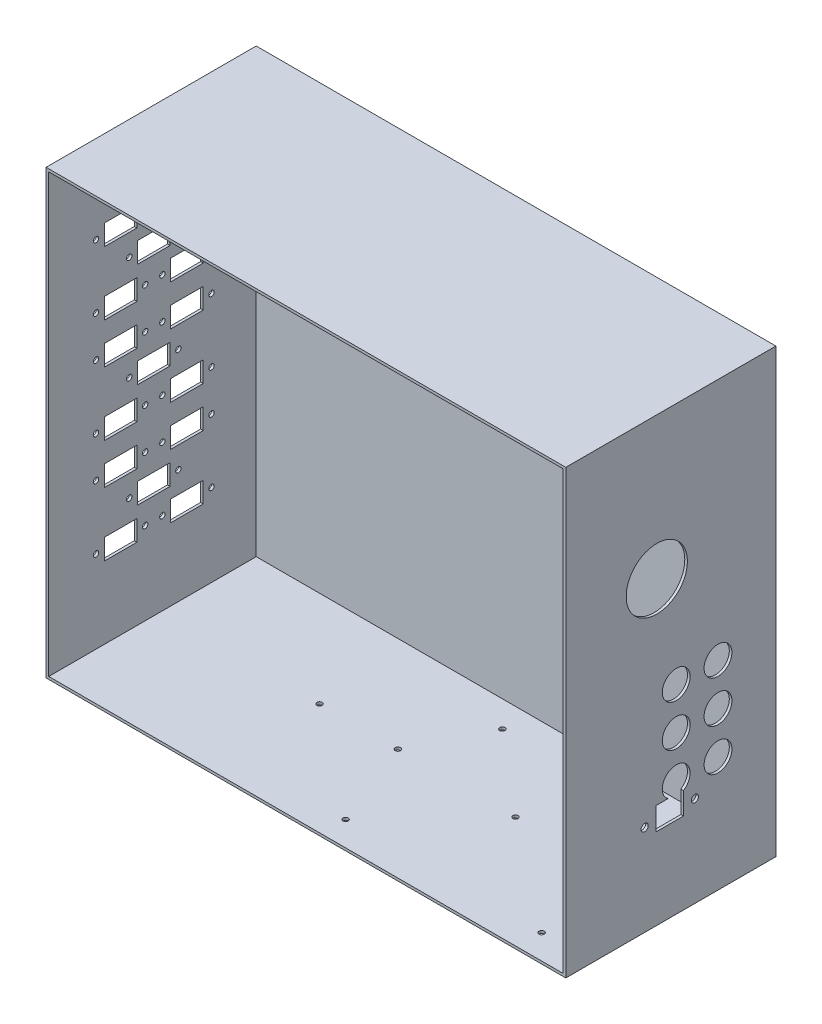
from build123d import *

# Parameters (mm, degrees)
SKETCH2_W                        = 298.45
SKETCH2_H                        = 254
BOSS_EXTRUDE1_DEPTH              = 120.65
SHELL1_T                         = -1.5
PT_CONNECTOR_CUTOUTS_REACH       = 348.06
SKETCH3_R                        = 8
SKETCH4_R                        = 1.55
SKETCH4_W                        = 18.7
SKETCH4_H                        = 11.8
SOLENOID_CONNECTOR_CUTOUTS_DEPTH = 1.5
SKETCH5_R                        = 1.524
PCB_MOUNTING_HOLES_DEPTH         = 1.5
SKETCH6_R                        = 17.574098895
CUT_EXTRUDE2_DEPTH               = 1.5
SKETCH7_R                        = 10.735729294
SKETCH7_R_2                      = 9.212667567
SKETCH7_R_3                      = 5.203861924
SKETCH7_R_4                      = 2.440691802
CUT_EXTRUDE3_DEPTH               = 1.5
SKETCH8_R                        = 2.06375
SKETCH8_W                        = 15.748
SKETCH8_H                        = 13.081
CUT_EXTRUDE4_DEPTH               = 1.5


with BuildPart() as part:
    # Sketch2 → Boss-Extrude1 (new body)
    with BuildSketch(Plane.XY):
        Rectangle(SKETCH2_W, SKETCH2_H)
    extrude(amount=BOSS_EXTRUDE1_DEPTH)

    # Shell1
    shell1_openings = [part.faces().sort_by_distance(p)[0] for p in [
        (0, 0, 120.65),
    ]]
    offset(amount=SHELL1_T, openings=shell1_openings, kind=Kind.INTERSECTION)

    # Sketch3 → PT Connector Cutouts (cut, up to next)
    with BuildSketch(Plane(origin=(149.225, 0, 0), x_dir=(0, 0, -1), z_dir=(1, 0, 0)), mode=Mode.PRIVATE) as pt_connector_cutouts_sk1:
        with Locations((-57.239729717, -60.69208043)):
            Circle(SKETCH3_R)
    pt_connector_cutouts_tool1 = extrude(pt_connector_cutouts_sk1.sketch, amount=-PT_CONNECTOR_CUTOUTS_REACH, mode=Mode.PRIVATE) & part.part
    # Sketch3 → PT Connector Cutouts (cut, up to next)
    with BuildSketch(Plane(origin=(149.225, 0, 0), x_dir=(0, 0, -1), z_dir=(1, 0, 0)), mode=Mode.PRIVATE) as pt_connector_cutouts_sk2:
        with Locations((-33.239729717, -60.69208043)):
            Circle(SKETCH3_R)
    pt_connector_cutouts_tool2 = extrude(pt_connector_cutouts_sk2.sketch, amount=-PT_CONNECTOR_CUTOUTS_REACH, mode=Mode.PRIVATE) & part.part
    # Sketch3 → PT Connector Cutouts (cut, up to next)
    with BuildSketch(Plane(origin=(149.225, 0, 0), x_dir=(0, 0, -1), z_dir=(1, 0, 0)), mode=Mode.PRIVATE) as pt_connector_cutouts_sk3:
        with Locations((-33.239729717, -36.69208043)):
            Circle(SKETCH3_R)
    pt_connector_cutouts_tool3 = extrude(pt_connector_cutouts_sk3.sketch, amount=-PT_CONNECTOR_CUTOUTS_REACH, mode=Mode.PRIVATE) & part.part
    # Sketch3 → PT Connector Cutouts (cut, up to next)
    with BuildSketch(Plane(origin=(149.225, 0, 0), x_dir=(0, 0, -1), z_dir=(1, 0, 0)), mode=Mode.PRIVATE) as pt_connector_cutouts_sk4:
        with Locations((-33.239729717, -12.69208043)):
            Circle(SKETCH3_R)
    pt_connector_cutouts_tool4 = extrude(pt_connector_cutouts_sk4.sketch, amount=-PT_CONNECTOR_CUTOUTS_REACH, mode=Mode.PRIVATE) & part.part
    # Sketch3 → PT Connector Cutouts (cut, up to next)
    with BuildSketch(Plane(origin=(149.225, 0, 0), x_dir=(0, 0, -1), z_dir=(1, 0, 0)), mode=Mode.PRIVATE) as pt_connector_cutouts_sk5:
        with Locations((-57.239729717, -36.69208043)):
            Circle(SKETCH3_R)
    pt_connector_cutouts_tool5 = extrude(pt_connector_cutouts_sk5.sketch, amount=-PT_CONNECTOR_CUTOUTS_REACH, mode=Mode.PRIVATE) & part.part
    # Sketch3 → PT Connector Cutouts (cut, up to next)
    with BuildSketch(Plane(origin=(149.225, 0, 0), x_dir=(0, 0, -1), z_dir=(1, 0, 0)), mode=Mode.PRIVATE) as pt_connector_cutouts_sk6:
        with Locations((-57.239729717, -12.69208043)):
            Circle(SKETCH3_R)
    pt_connector_cutouts_tool6 = extrude(pt_connector_cutouts_sk6.sketch, amount=-PT_CONNECTOR_CUTOUTS_REACH, mode=Mode.PRIVATE) & part.part
    add(pt_connector_cutouts_tool1.solids().sort_by_distance((149.225, -60.69208, 57.23973))[0], mode=Mode.SUBTRACT)
    add(pt_connector_cutouts_tool2.solids().sort_by_distance((149.225, -60.69208, 33.23973))[0], mode=Mode.SUBTRACT)
    add(pt_connector_cutouts_tool3.solids().sort_by_distance((149.225, -36.69208, 33.23973))[0], mode=Mode.SUBTRACT)
    add(pt_connector_cutouts_tool4.solids().sort_by_distance((149.225, -12.69208, 33.23973))[0], mode=Mode.SUBTRACT)
    add(pt_connector_cutouts_tool5.solids().sort_by_distance((149.225, -36.69208, 57.23973))[0], mode=Mode.SUBTRACT)
    add(pt_connector_cutouts_tool6.solids().sort_by_distance((149.225, -12.69208, 57.23973))[0], mode=Mode.SUBTRACT)

    # Sketch4 → Solenoid Connector Cutouts (cut)
    with BuildSketch(Plane.ZY.offset(149.225)):
        with Locations(Location((55.387501773, 78.156254231, 0), (0, 0, 270))):
            Circle(SKETCH4_R)
        with Locations(Location((27.162501773, 78.156254231, 0), (0, 0, 90))):
            Circle(SKETCH4_R)
        with Locations(Location((93.487501773, 78.156254231, 0), (0, 0, 270))):
            Circle(SKETCH4_R)
        with Locations(Location((65.262501773, 78.156254231, 0), (0, 0, 90))):
            Circle(SKETCH4_R)
        with Locations(Location((93.487501773, 41.643754231, 0), (0, 0, 270))):
            Circle(SKETCH4_R)
        with Locations(Location((65.262501773, 41.643754231, 0), (0, 0, 90))):
            Circle(SKETCH4_R)
        with Locations(Location((93.487501773, 18.256254231, 0), (0, 0, 270))):
            Circle(SKETCH4_R)
        with Locations(Location((65.262501773, 18.256254231, 0), (0, 0, 90))):
            Circle(SKETCH4_R)
        with Locations(Location((93.487501773, -18.256245769, 0), (0, 0, 270))):
            Circle(SKETCH4_R)
        with Locations(Location((65.262501773, -18.256245769, 0), (0, 0, 90))):
            Circle(SKETCH4_R)
        with Locations(Location((93.487501773, -41.643745769, 0), (0, 0, 270))):
            Circle(SKETCH4_R)
        with Locations(Location((65.262501773, -41.643745769, 0), (0, 0, 90))):
            Circle(SKETCH4_R)
        with Locations(Location((93.487501773, -78.156245769, 0), (0, 0, 270))):
            Circle(SKETCH4_R)
        with Locations(Location((65.262501773, -78.156245769, 0), (0, 0, 90))):
            Circle(SKETCH4_R)
        with Locations(Location((74.437501773, 59.900004231, 0), (0, 0, 270))):
            Circle(SKETCH4_R)
        with Locations(Location((46.212501773, 59.900004231, 0), (0, 0, 90))):
            Circle(SKETCH4_R)
        with Locations(Location((55.387501773, 41.643754231, 0), (0, 0, 270))):
            Circle(SKETCH4_R)
        with Locations(Location((27.162501773, 41.643754231, 0), (0, 0, 90))):
            Circle(SKETCH4_R)
        with Locations(Location((55.387501773, 18.256254231, 0), (0, 0, 270))):
            Circle(SKETCH4_R)
        with Locations(Location((27.162501773, 18.256254231, 0), (0, 0, 90))):
            Circle(SKETCH4_R)
        with Locations(Location((74.437501773, 4.231e-06, 0), (0, 0, 270))):
            Circle(SKETCH4_R)
        with Locations(Location((46.212501773, 4.231e-06, 0), (0, 0, 90))):
            Circle(SKETCH4_R)
        with Locations(Location((55.387501773, -18.256245769, 0), (0, 0, 270))):
            Circle(SKETCH4_R)
        with Locations(Location((27.162501773, -18.256245769, 0), (0, 0, 90))):
            Circle(SKETCH4_R)
        with Locations(Location((55.387501773, -41.643745769, 0), (0, 0, 270))):
            Circle(SKETCH4_R)
        with Locations(Location((27.162501773, -41.643745769, 0), (0, 0, 90))):
            Circle(SKETCH4_R)
        with Locations(Location((74.437501773, -59.899995769, 0), (0, 0, 270))):
            Circle(SKETCH4_R)
        with Locations(Location((46.212501773, -59.899995769, 0), (0, 0, 90))):
            Circle(SKETCH4_R)
        with Locations(Location((55.387501773, -78.156245769, 0), (0, 0, 270))):
            Circle(SKETCH4_R)
        with Locations(Location((27.162501773, -78.156245769, 0), (0, 0, 90))):
            Circle(SKETCH4_R)
        with Locations((41.275001773, 78.156254231)):
            Rectangle(SKETCH4_W, SKETCH4_H)
        with Locations((79.375001773, 78.156254231)):
            Rectangle(SKETCH4_W, SKETCH4_H)
        with Locations((79.375001773, 41.643754231)):
            Rectangle(SKETCH4_W, SKETCH4_H)
        with Locations((79.375001773, 18.256254231)):
            Rectangle(SKETCH4_W, SKETCH4_H)
        with Locations((79.375001773, -18.256245769)):
            Rectangle(SKETCH4_W, SKETCH4_H)
        with Locations((79.375001773, -41.643745769)):
            Rectangle(SKETCH4_W, SKETCH4_H)
        with Locations((79.375001773, -78.156245769)):
            Rectangle(SKETCH4_W, SKETCH4_H)
        with Locations((60.325001773, 59.900004231)):
            Rectangle(SKETCH4_W, SKETCH4_H)
        with Locations((41.275001773, 41.643754231)):
            Rectangle(SKETCH4_W, SKETCH4_H)
        with Locations((41.275001773, 18.256254231)):
            Rectangle(SKETCH4_W, SKETCH4_H)
        with Locations((60.325001773, 4.231e-06)):
            Rectangle(SKETCH4_W, SKETCH4_H)
        with Locations((41.275001773, -18.256245769)):
            Rectangle(SKETCH4_W, SKETCH4_H)
        with Locations((41.275001773, -41.643745769)):
            Rectangle(SKETCH4_W, SKETCH4_H)
        with Locations((60.325001773, -59.899995769)):
            Rectangle(SKETCH4_W, SKETCH4_H)
        with Locations((41.275001773, -78.156245769)):
            Rectangle(SKETCH4_W, SKETCH4_H)
    extrude(amount=-SOLENOID_CONNECTOR_CUTOUTS_DEPTH, mode=Mode.SUBTRACT)

    # Sketch5 → PCB Mounting Holes (cut)
    with BuildSketch(Plane(origin=(0, -127, 127), x_dir=(-1, 0, 0), z_dir=(0, 1, 0))):
        with Locations(Location((-121.235859114, -20.462314931, 0), (0, 0, 270))):
            Circle(SKETCH5_R)
        with Locations(Location((-56.235859114, -70.462314931, 0), (0, 0, 270))):
            Circle(SKETCH5_R)
        with Locations(Location((-121.235859114, -110.462314931, 0), (0, 0, 270))):
            Circle(SKETCH5_R)
        with Locations(Location((-101.235859114, -70.462314931, 0), (0, 0, 270))):
            Circle(SKETCH5_R)
        with Locations(Location((-8.675032002, -20.462314931, 0), (0, 0, 270))):
            Circle(SKETCH5_R)
        with Locations(Location((56.324967998, -70.462314931, 0), (0, 0, 270))):
            Circle(SKETCH5_R)
        with Locations(Location((-8.675032002, -110.462314931, 0), (0, 0, 270))):
            Circle(SKETCH5_R)
        with Locations(Location((11.324967998, -70.462314931, 0), (0, 0, 270))):
            Circle(SKETCH5_R)
    extrude(amount=PCB_MOUNTING_HOLES_DEPTH, mode=Mode.SUBTRACT)

    # Sketch6 → Cut-Extrude2 (cut)
    with BuildSketch(Plane(origin=(149.225, 0, 0), x_dir=(0, 0, -1), z_dir=(1, 0, 0))):
        with Locations((-68.387091128, 45.43625367)):
            Circle(SKETCH6_R)
    extrude(amount=-CUT_EXTRUDE2_DEPTH, mode=Mode.SUBTRACT)

    # Sketch7 → Cut-Extrude3 (cut)
    with BuildSketch(Plane(origin=(0, 0, 0), x_dir=(-1, 0, 0), z_dir=(0, 0, -1))):
        with Locations((75.19126283, 21.756760288)):
            Circle(SKETCH7_R)
        with Locations((46.368160054, 57.132321186)):
            Circle(SKETCH7_R_2)
        with Locations((69.95079545, 74.993212306)):
            Circle(SKETCH7_R_3)
        with Locations((46.368160054, 28.685666471)):
            Circle(SKETCH7_R_4)
    extrude(amount=-CUT_EXTRUDE3_DEPTH, mode=Mode.SUBTRACT)

    # Sketch8 → Cut-Extrude4 (cut)
    with BuildSketch(Plane.ZY.offset(-149.225)):
        with Locations((46.52594904, -74.819755611)):
            Circle(SKETCH8_R)
        with Locations(Location((75.35494904, -74.819755611, 0), (0, 0, 180))):
            Circle(SKETCH8_R)
        with Locations((60.94044904, -73.691658038)):
            Rectangle(SKETCH8_W, SKETCH8_H)
    extrude(amount=CUT_EXTRUDE4_DEPTH, mode=Mode.SUBTRACT)


solid = part.part
